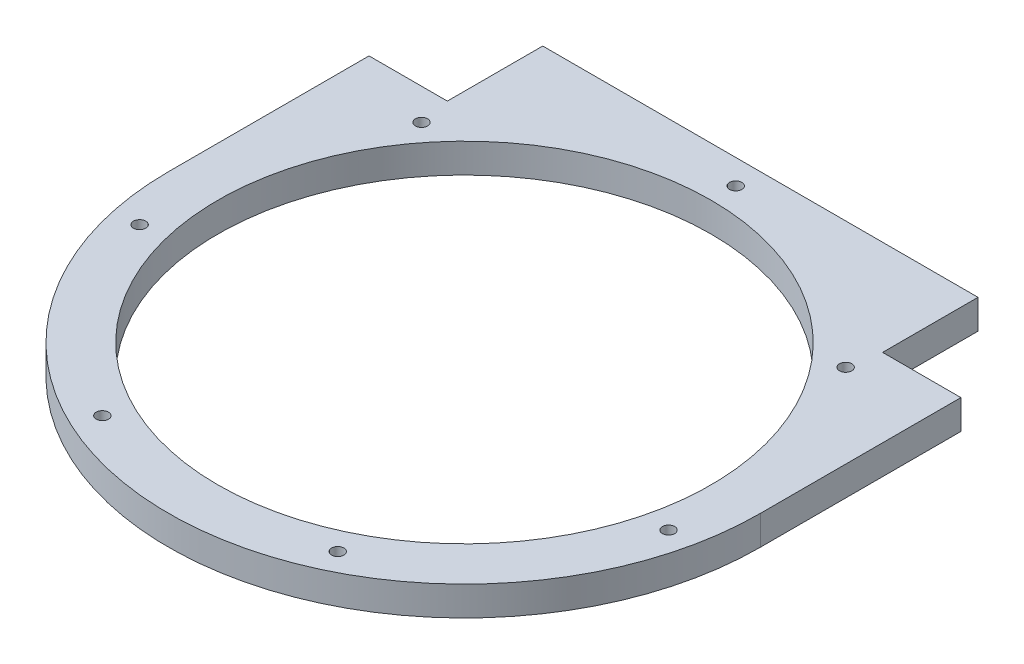
from build123d import *

# Parameters (mm, degrees)
SKETCH1_R           = 40
SKETCH1_R_2         = 1
BOSS_EXTRUDE1_DEPTH = 4.7625


with BuildPart() as part:
    # Sketch1 → Boss-Extrude1 (new body)
    with BuildSketch(Plane(origin=(0, 0, 0), x_dir=(1, 0, 0), z_dir=(0, 1, 0))):
        with BuildLine():
            Line((-35.3, 48), (-35.3, 32.525528435))
            Line((-35.3, 32.525528435), (-48, 32.525528435))
            Line((-48, 32.525528435), (-48, 0))
            ThreePointArc((-48, 0), (0, -48), (48, 0))
            Line((48, 0), (48, 32.525528435))
            Line((48, 32.525528435), (35.3, 32.525528435))
            Line((35.3, 32.525528435), (35.3, 48))
            Line((35.3, 48), (-35.3, 48))
        make_face()
        Circle(SKETCH1_R, mode=Mode.SUBTRACT)
        with Locations((34.400585229, 27.433551282)):
            Circle(SKETCH1_R_2, mode=Mode.SUBTRACT)
        with Locations((-34.400585229, 27.433551282)):
            Circle(SKETCH1_R_2, mode=Mode.SUBTRACT)
        with Locations((0, 44)):
            Circle(SKETCH1_R_2, mode=Mode.SUBTRACT)
        with Locations((19.090884521, -39.642630188)):
            Circle(SKETCH1_R_2, mode=Mode.SUBTRACT)
        with Locations((42.896828136, -9.790921094)):
            Circle(SKETCH1_R_2, mode=Mode.SUBTRACT)
        with Locations((-19.090884521, -39.642630188)):
            Circle(SKETCH1_R_2, mode=Mode.SUBTRACT)
        with Locations((-42.896828136, -9.790921094)):
            Circle(SKETCH1_R_2, mode=Mode.SUBTRACT)
    extrude(amount=BOSS_EXTRUDE1_DEPTH)


solid = part.part
